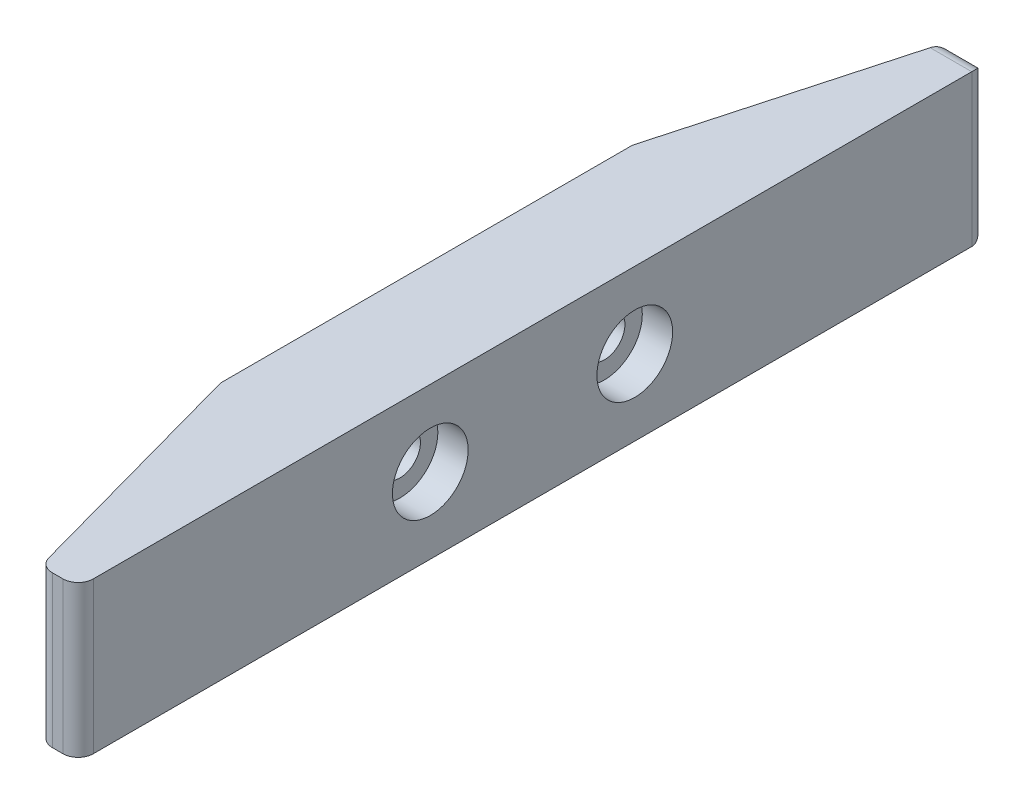
from build123d import *

# Parameters (mm, degrees)
SKETCH1_W           = 33.537053001
SKETCH1_H           = 60
BOSS_EXTRUDE1_DEPTH = 10
SKETCH2_R           = 1.35
CUT_EXTRUDE1_DEPTH  = 10
CUT_EXTRUDE3_DEPTH  = 18
SKETCH10_W          = 20.892081227
SKETCH10_H          = 64.192604416
CUT_EXTRUDE4_DEPTH  = 26
SKETCH15_W          = 6.200817496
SKETCH15_H          = 60
CUT_EXTRUDE5_DEPTH  = 26
FILLET1_R           = 1
SKETCH16_R          = 2.5
CUT_EXTRUDE6_DEPTH  = 2


with BuildPart() as part:
    # Sketch1 → Boss-Extrude1 (new body)
    with BuildSketch(Plane(origin=(0, 0, 0), x_dir=(1, 0, 0), z_dir=(0, 1, 0))):
        with Locations((16.768526501, 0)):
            Rectangle(SKETCH1_W, SKETCH1_H)
    extrude(amount=BOSS_EXTRUDE1_DEPTH)

    # Sketch2 → Cut-Extrude1 (cut)
    with BuildSketch(Plane.ZY):
        with Locations((-6.75, 5)):
            Circle(SKETCH2_R)
        with Locations(Location((6.75, 5, 0), (0, 0, 180))):
            Circle(SKETCH2_R)
    extrude(amount=-CUT_EXTRUDE1_DEPTH, mode=Mode.SUBTRACT)

    # Sketch5 → Cut-Extrude3 (cut)
    with BuildSketch(Plane(origin=(0, 10, 0), x_dir=(1, 0, 0), z_dir=(0, 1, 0))):
        Polygon((0, 13.591085099), (4.530530491, 30), (0, 30), align=None)
        Polygon((0, -30), (4.530530491, -30), (0, -13.591085099), align=None)
    extrude(amount=-CUT_EXTRUDE3_DEPTH, mode=Mode.SUBTRACT)

    # Sketch10 → Cut-Extrude4 (cut)
    with BuildSketch(Plane(origin=(0, 10, 0), x_dir=(1, 0, 0), z_dir=(0, 1, 0))):
        with Locations((23.64685811, -0.926664893)):
            Rectangle(SKETCH10_W, SKETCH10_H)
    extrude(amount=-CUT_EXTRUDE4_DEPTH, mode=Mode.SUBTRACT)

    # Sketch15 → Cut-Extrude5 (cut)
    with BuildSketch(Plane(origin=(0, 10, 0), x_dir=(1, 0, 0), z_dir=(0, 1, 0))):
        with Locations((10.100408748, 0)):
            Rectangle(SKETCH15_W, SKETCH15_H)
    extrude(amount=-CUT_EXTRUDE5_DEPTH, mode=Mode.SUBTRACT)

    # Fillet1
    fillet1_edges = [part.edges().sort_by_distance(p)[0] for p in [
        (5.765265246, 0, -30),
        (5.765265246, 10, -30),
        (4.530530491, 5, -30),
        (4.530530491, 5, 30),
        (7, 5, 30),
        (7, 5, -30),
    ]]
    fillet(fillet1_edges, radius=FILLET1_R)

    # Sketch16 → Cut-Extrude6 (cut)
    with BuildSketch(Plane(origin=(7, 0, 0), x_dir=(0, 0, -1), z_dir=(1, 0, 0))):
        with Locations((-6.75, 5)):
            Circle(SKETCH16_R)
        with Locations((6.75, 5)):
            Circle(SKETCH16_R)
    extrude(amount=-CUT_EXTRUDE6_DEPTH, mode=Mode.SUBTRACT)


solid = part.part
